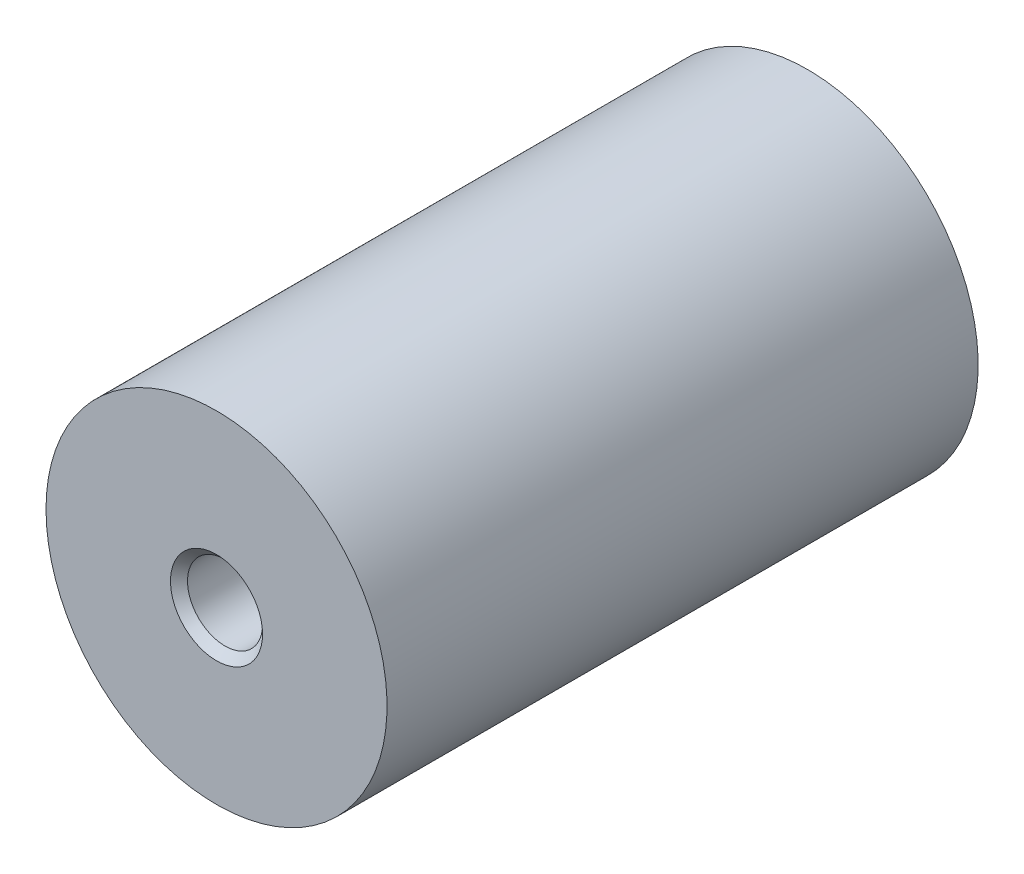
from build123d import *

# Parameters (mm, degrees)
SKETCH1_R                       = 7.5
BOSS_EXTRUDE1_DEPTH             = 13
M4X0_7_TAPPED_HOLE1_D           = 3.3
M4X0_7_TAPPED_HOLE1_CSINK_D     = 4.05
M4X0_7_TAPPED_HOLE1_CSINK_ANGLE = 90


with BuildPart() as part:
    # Sketch1 → Boss-Extrude1 (new, symmetric)
    with BuildSketch(Plane.XY):
        with Locations(Location((0, 0, 0), (0, 0, 180))):
            Circle(SKETCH1_R)
    extrude(amount=BOSS_EXTRUDE1_DEPTH, both=True)

    # M4x0.7 Tapped Hole1 (through all)
    with Locations(Plane.XY.offset(13)):
        with Locations((0, 0)):
            CounterSinkHole(M4X0_7_TAPPED_HOLE1_D / 2, M4X0_7_TAPPED_HOLE1_CSINK_D / 2, counter_sink_angle=M4X0_7_TAPPED_HOLE1_CSINK_ANGLE)


solid = part.part
